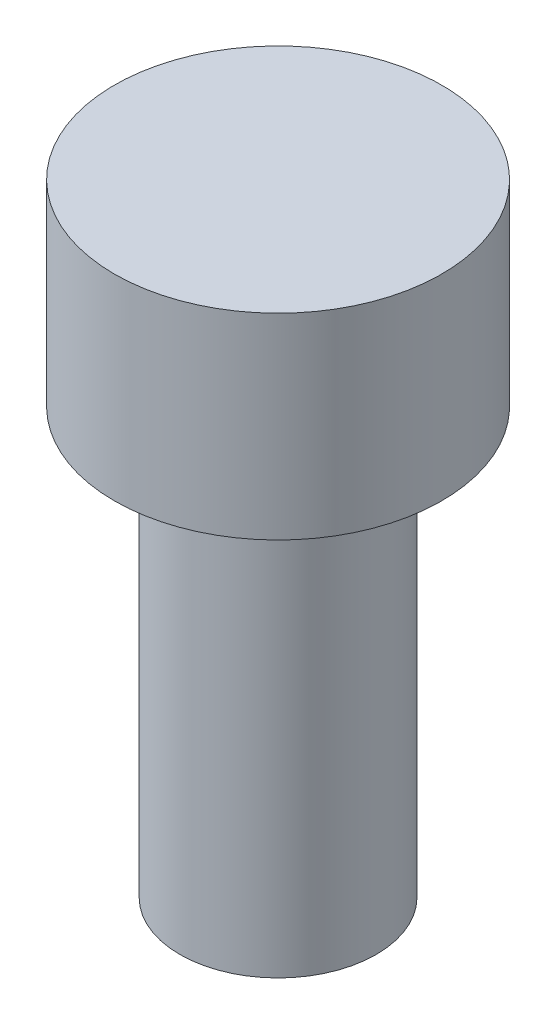
from build123d import *

# Parameters (mm, degrees)
SKETCH_1_R      = 3
EXTRUDE_1_DEPTH = 13
SKETCH_2_R      = 5
EXTRUDE_2_DEPTH = 6


with BuildPart() as part:
    # 草图1 → 凸台-拉伸1 (new body)
    with BuildSketch(Plane(origin=(0, 0, 0), x_dir=(1, 0, 0), z_dir=(0, 1, 0))):
        with Locations(Location((0, 0, 0), (0, 0, 90))):
            Circle(SKETCH_1_R)
    extrude(amount=EXTRUDE_1_DEPTH)

    # 草图2 → 凸台-拉伸2 (add)
    with BuildSketch(Plane(origin=(0, 13, 0), x_dir=(1, 0, 0), z_dir=(0, 1, 0))):
        with Locations(Location((0, 0, 0), (0, 0, 270))):
            Circle(SKETCH_2_R)
    extrude(amount=EXTRUDE_2_DEPTH)


solid = part.part
